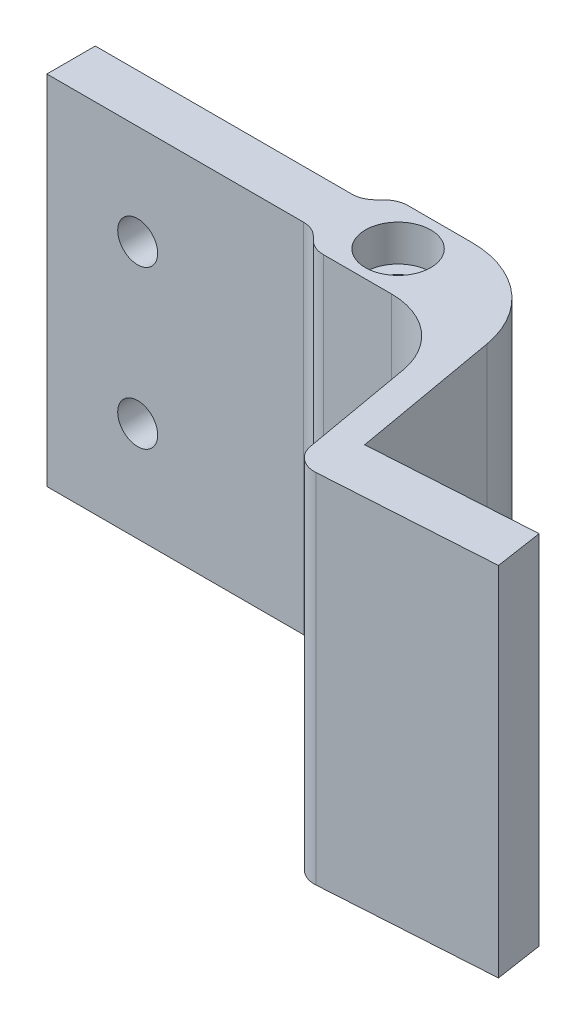
from build123d import *

# Parameters (mm, degrees)
SKETCH1_R             = 1.65
BOSS_EXTRUDE1_DEPTH   = 29.5
SKETCH2_R             = 6.25
MAGNET_POCKET_DEPTH   = 3.234778792
SKETCH4_R             = 2.7
CUT_EXTRUDE3_DEPTH    = 3
CUT_EXTRUDE4_START    = -3
SKETCH5_R             = 2.7
CUT_EXTRUDE4_DEPTH    = 3
SKETCH3_R             = 1.65
PADDLE_MOUNT_M3_DEPTH = 4
FILLET4_R             = 8
FILLET5_R             = 6
FILLET6_R             = 2
FILLET7_R             = 2
FILLET8_R             = 2
FILLET9_R             = 2
FILLET10_R            = 2


with BuildPart() as part:
    # Sketch1 → Boss-Extrude1 (new body)
    with BuildSketch(Plane(origin=(0, 0, 0), x_dir=(1, 0, 0), z_dir=(0, 1, 0))):
        Polygon((0, 4), (22, 4), (23.5, 5.5), (30.5, 5.5), (36.304277665, 5.5), (39.635761777, -13.393785279), (53.192961039, -12.54480053), (53.789951114, -16.5), (37.821231691, -17.5), (35, -1.5), (23.5, -1.5), (22, 0), (0, 0), align=None)
        with Locations(Location((27, 2, 0), (0, 0, 270))):
            Circle(SKETCH1_R, mode=Mode.SUBTRACT)
    extrude(amount=BOSS_EXTRUDE1_DEPTH)

    # Sketch2 → Magnet Pocket (cut)
    with BuildSketch(Plane(origin=(0.990302191, 0, 15.813857833), x_dir=(-0.9980449639169571, 0, 0.06249999999999972), z_dir=(-0.06249999999999972, 0, -0.9980449639169571))):
        with Locations((-44.971160853, 14.75)):
            Circle(SKETCH2_R)
    extrude(amount=-MAGNET_POCKET_DEPTH, mode=Mode.SUBTRACT)

    # Sketch4 → Cut-Extrude3 (cut)
    with BuildSketch(Plane(origin=(0, 29.5, 0), x_dir=(1, 0, 0), z_dir=(0, 1, 0))):
        with Locations(Location((27, 2, 0), (0, 0, 270))):
            Circle(SKETCH4_R)
    extrude(amount=-CUT_EXTRUDE3_DEPTH, mode=Mode.SUBTRACT)

    # Sketch5 → Cut-Extrude4 (cut)
    with BuildSketch(Plane.XZ.offset(CUT_EXTRUDE4_START)):
        with Locations(Location((27, -2, 0), (0, 0, 90))):
            Circle(SKETCH5_R)
    extrude(amount=CUT_EXTRUDE4_DEPTH, mode=Mode.SUBTRACT)

    # Sketch3 → Paddle Mount M3 (cut)
    with BuildSketch(Plane(origin=(0, 0, -4), x_dir=(-1, 0, 0), z_dir=(0, 0, -1))):
        with Locations((-7.5, 8.25)):
            Circle(SKETCH3_R)
        with Locations((-7.5, 21.25)):
            Circle(SKETCH3_R)
    extrude(amount=-PADDLE_MOUNT_M3_DEPTH, mode=Mode.SUBTRACT)

    # Fillet4
    fillet4_edges = [part.edges().sort_by_distance(p)[0] for p in [
        (36.304277665, 14.75, -5.5),
    ]]
    fillet(fillet4_edges, radius=FILLET4_R)

    # Fillet5
    fillet5_edges = [part.edges().sort_by_distance(p)[0] for p in [
        (35, 14.75, 1.5),
    ]]
    fillet(fillet5_edges, radius=FILLET5_R)

    # Fillet6
    fillet6_edges = [part.edges().sort_by_distance(p)[0] for p in [
        (37.821231691, 14.75, 17.5),
    ]]
    fillet(fillet6_edges, radius=FILLET6_R)

    # Fillet7
    fillet7_edges = [part.edges().sort_by_distance(p)[0] for p in [
        (23.5, 14.75, -5.5),
    ]]
    fillet(fillet7_edges, radius=FILLET7_R)

    # Fillet8
    fillet8_edges = [part.edges().sort_by_distance(p)[0] for p in [
        (22, 14.75, -4),
    ]]
    fillet(fillet8_edges, radius=FILLET8_R)

    # Fillet9
    fillet9_edges = [part.edges().sort_by_distance(p)[0] for p in [
        (23.5, 14.75, 1.5),
    ]]
    fillet(fillet9_edges, radius=FILLET9_R)

    # Fillet10
    fillet10_edges = [part.edges().sort_by_distance(p)[0] for p in [
        (22, 14.75, 0),
    ]]
    fillet(fillet10_edges, radius=FILLET10_R)


solid = part.part
